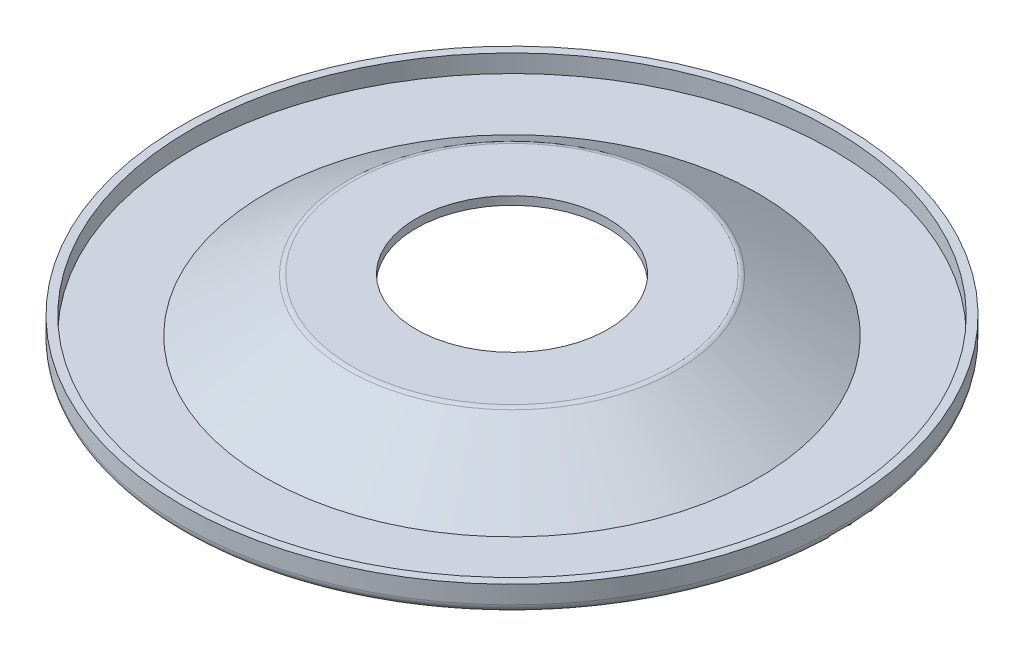
from build123d import *


with BuildPart() as part:
    # Croquis1 → Revolución1 (revolve)
    with BuildSketch(Plane.XY, mode=Mode.PRIVATE) as revoluci_n1_sk:
        with BuildLine():
            Line((-8.065, 0), (-13.45, 0))
            ThreePointArc((-13.45, 0), (-13.646270241, -0.028078879), (-13.826794629, -0.110062878))
            Line((-13.826794629, -0.110062878), (-20.7, -4.5))
            Line((-20.7, -4.5), (-27, -4.5))
            Line((-27, -4.5), (-27, -3))
            Line((-27, -3), (-27.7, -3))
            Line((-27.7, -3), (-27.7, -4.5))
            ThreePointArc((-27.7, -4.5), (-27.494974747, -4.994974747), (-27, -5.2))
            Line((-27, -5.2), (-20.7, -5.2))
            ThreePointArc((-20.7, -5.2), (-20.503729759, -5.171921121), (-20.323205371, -5.089937122))
            Line((-20.323205371, -5.089937122), (-13.45, -0.7))
            Line((-13.45, -0.7), (-8.065, -0.7))
            Line((-8.065, -0.7), (-8.065, 0))
        make_face()
    revolve(revoluci_n1_sk.sketch.rotate(Axis((0, 0, 0), (0, 1, 0)), 270), axis=Axis((0, 0, 0), (0, 1, 0)))


solid = part.part
